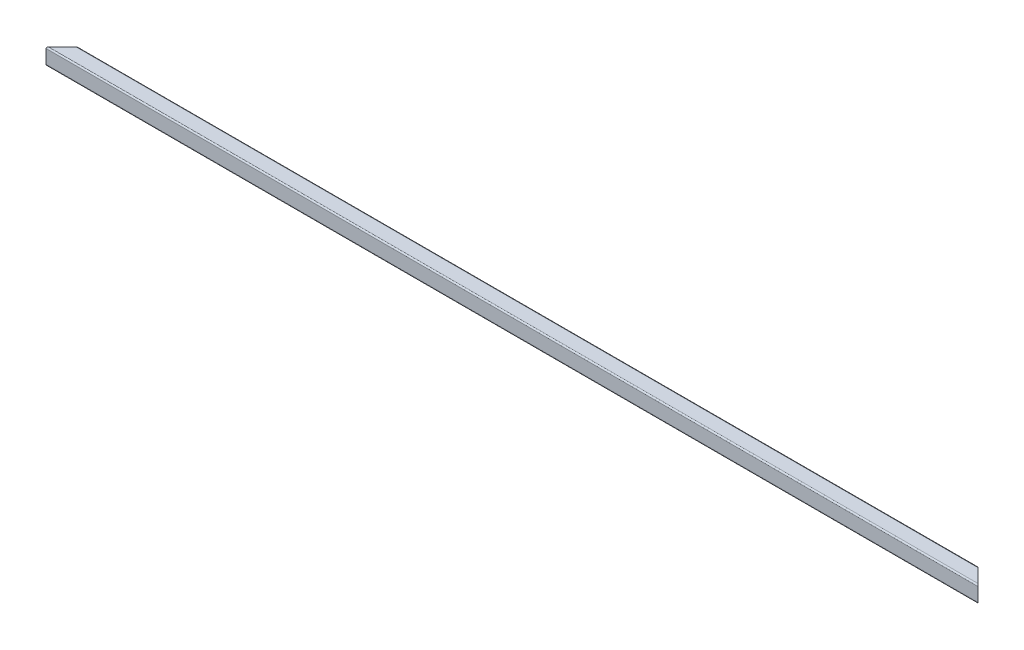
from build123d import *

# Parameters (mm, degrees)
SKETCH1_W           = 23.495
SKETCH1_H           = 23.495
BOSS_EXTRUDE1_DEPTH = 723.9
SCALE1_SCALE_X      = 1
SCALE1_SCALE_Y      = 0.4
SCALE1_SCALE_Z      = 0.4
CUT_EXTRUDE1_DEPTH  = 725.352435474


with BuildPart() as part:
    # Sketch1 → Boss-Extrude1 (new body)
    with BuildSketch(Plane(origin=(0, 0, 0), x_dir=(0, 0, -1), z_dir=(1, 0, 0))):
        with BuildLine():
            Line((0, 2.54), (0, 29.21))
            ThreePointArc((0, 29.21), (-0.743948776, 31.006051224), (-2.54, 31.75))
            Line((-2.54, 31.75), (-29.21, 31.75))
            ThreePointArc((-29.21, 31.75), (-31.006051224, 31.006051224), (-31.75, 29.21))
            Line((-31.75, 29.21), (-31.75, 2.54))
            ThreePointArc((-31.75, 2.54), (-31.006051224, 0.743948776), (-29.21, 0))
            Line((-29.21, 0), (-2.54, 0))
            ThreePointArc((-2.54, 0), (-0.743948776, 0.743948776), (0, 2.54))
        make_face()
        with Locations((-15.875, 15.875)):
            Rectangle(SKETCH1_W, SKETCH1_H, mode=Mode.SUBTRACT)
    extrude(amount=BOSS_EXTRUDE1_DEPTH)


with BuildPart() as part_1:
    # Scale1: scaled about (361.95, 15.875, 15.875)
    add(part.part.scale((SCALE1_SCALE_X, SCALE1_SCALE_Y, SCALE1_SCALE_Z), about=(361.95, 15.875, 15.875)))

    # Sketch3 → Cut-Extrude1 (cut, through all)
    with BuildSketch(Plane(origin=(0, 22.225, 0), x_dir=(1, 0, 0), z_dir=(0, 1, 0))):
        Polygon((0, -9.525), (0, -22.225), (12.7, -9.525), align=None)
        Polygon((723.9, -9.525), (723.9, -22.225), (711.2, -9.525), align=None)
    extrude(amount=-CUT_EXTRUDE1_DEPTH, mode=Mode.SUBTRACT)


solid = part_1.part
